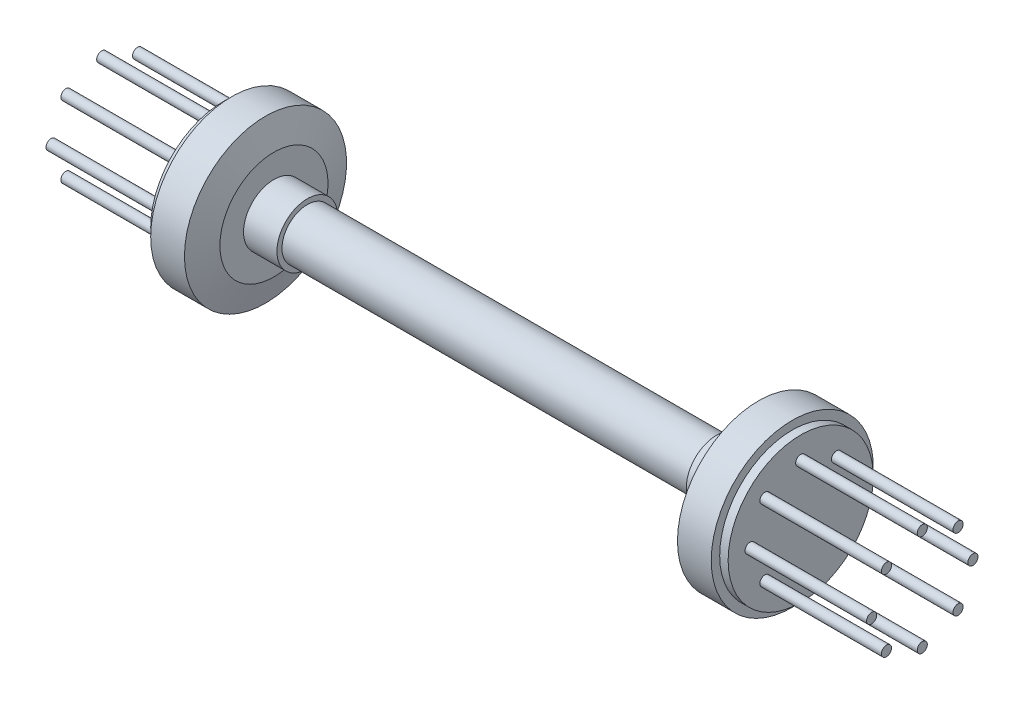
from build123d import *

# Parameters (mm, degrees)
SKETCH2_R           = 15
BOSS_EXTRUDE1_DEPTH = 360


with BuildPart() as part:
    # Sketch1 → Revolve1 (revolve)
    with BuildSketch(Plane.XY, mode=Mode.PRIVATE) as revolve1_sk:
        Polygon((-855, 0), (-855, 215), (-830, 215), (-830, 240), (-730, 240), (-705, 160), (-705, 90), (-606.156213382, 90), (-606.156213382, 75), (-129.903810568, 75), (129.903810568, 75), (606.156213382, 75), (606.156213382, 90), (705, 90), (705, 160), (730, 240), (830, 240), (830, 215), (855, 215), (855, 0), align=None)
    revolve(revolve1_sk.sketch.rotate(Axis((-1250, 0, 0), (1, 0, 0)), 90), axis=Axis((-1250, 0, 0), (1, 0, 0)))

    # Sketch2 → Boss-Extrude1 (add)
    with BuildSketch(Plane.ZY.offset(855)):
        with Locations(Location((0, 150, 0), (0, 0, 180))):
            Circle(SKETCH2_R)
        with Locations(Location((106.066017178, 106.066017178, 0), (0, 0, 180))):
            Circle(SKETCH2_R)
        with Locations(Location((150, 0, 0), (0, 0, 180))):
            Circle(SKETCH2_R)
        with Locations(Location((106.066017178, -106.066017178, 0), (0, 0, 180))):
            Circle(SKETCH2_R)
        with Locations(Location((0, -150, 0), (0, 0, 180))):
            Circle(SKETCH2_R)
        with Locations(Location((-106.066017178, -106.066017178, 0), (0, 0, 180))):
            Circle(SKETCH2_R)
        with Locations(Location((-150, 0, 0), (0, 0, 180))):
            Circle(SKETCH2_R)
        with Locations(Location((-106.066017178, 106.066017178, 0), (0, 0, 180))):
            Circle(SKETCH2_R)
    boss_extrude1 = extrude(amount=BOSS_EXTRUDE1_DEPTH)

    # Mirror1: Boss-Extrude1 across plane
    add(boss_extrude1.mirror(Plane(origin=(0, 0, 0), x_dir=(0, 0, 1), z_dir=(1, 0, 0))))


solid = part.part
